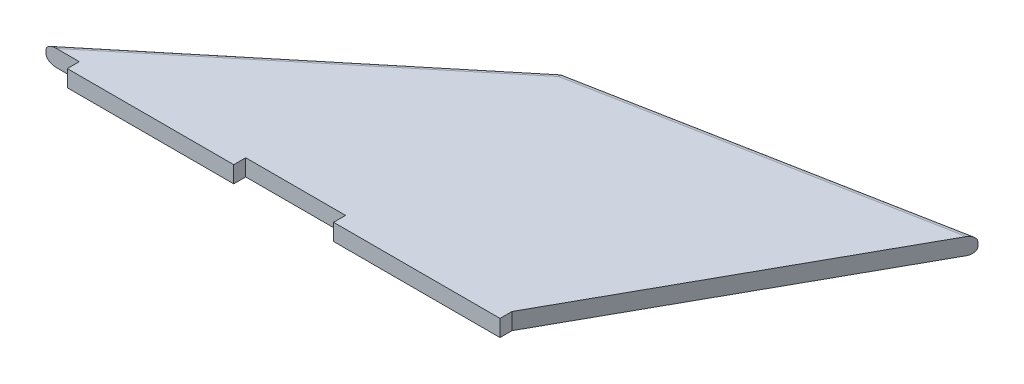
from build123d import *

# Parameters (mm, degrees)
BOSS_EXTRUDE1_DEPTH = 2.5
FILLET1_R           = 1


with BuildPart() as part:
    # Sketch1 → Boss-Extrude1 (new body)
    with BuildSketch(Plane(origin=(0, 0, 0), x_dir=(1, 0, 0), z_dir=(0, 1, 0))):
        Polygon((0, 0), (42.5, 35), (95, 45), (70, 0), (70, -1.8), (45, -1.8), (45, 0), (30, 0), (30, -1.8), (5, -1.8), (5, 0), align=None)
    extrude(amount=BOSS_EXTRUDE1_DEPTH)

    # Fillet1
    fillet1_edges = [part.edges().sort_by_distance(p)[0] for p in [
        (21.25, 0, -17.5),
        (68.75, 0, -40),
        (42.5, 1.25, -35),
        (68.75, 2.5, -40),
        (21.25, 2.5, -17.5),
    ]]
    fillet(fillet1_edges, radius=FILLET1_R)


solid = part.part
